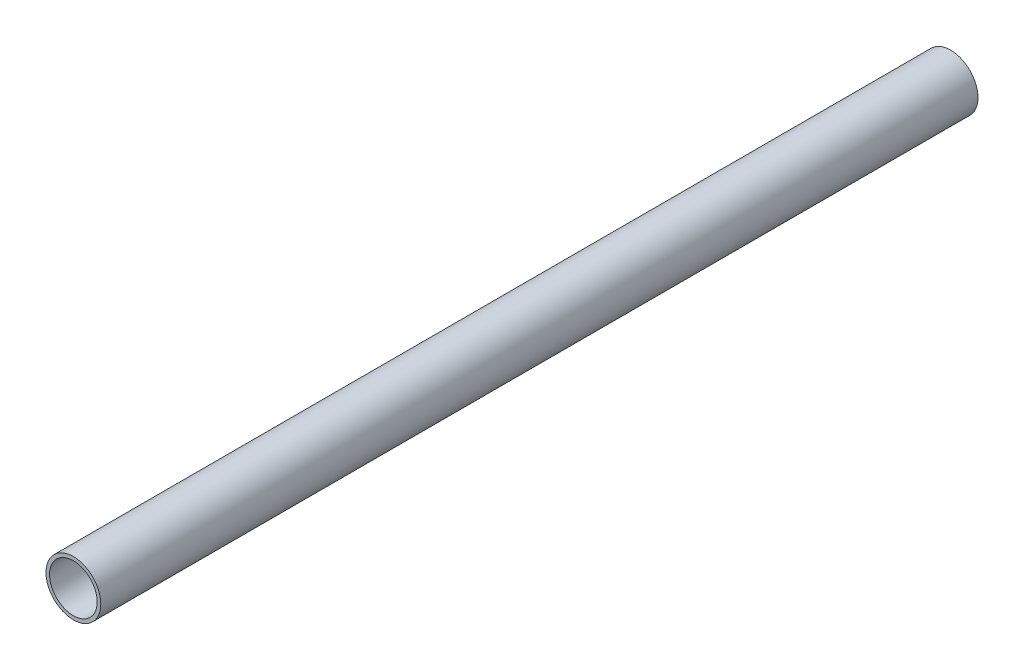
from build123d import *

# Parameters (mm, degrees)
BOSS_EXTRUDE1_DEPTH      = 152.4
BOSS_EXTRUDE1_DEPTH_BACK = 152.4
SKETCH3_R                = 9.525
SKETCH3_R_2              = 8.2804


with BuildPart() as part:
    # Sketch3 → Boss-Extrude1 (new, two sides: drawn at the far end of the back side and taken through both)
    with BuildSketch(Plane.XY.offset(-BOSS_EXTRUDE1_DEPTH_BACK)):
        Circle(SKETCH3_R)
        Circle(SKETCH3_R_2, mode=Mode.SUBTRACT)
    extrude(amount=BOSS_EXTRUDE1_DEPTH + BOSS_EXTRUDE1_DEPTH_BACK)


solid = part.part
